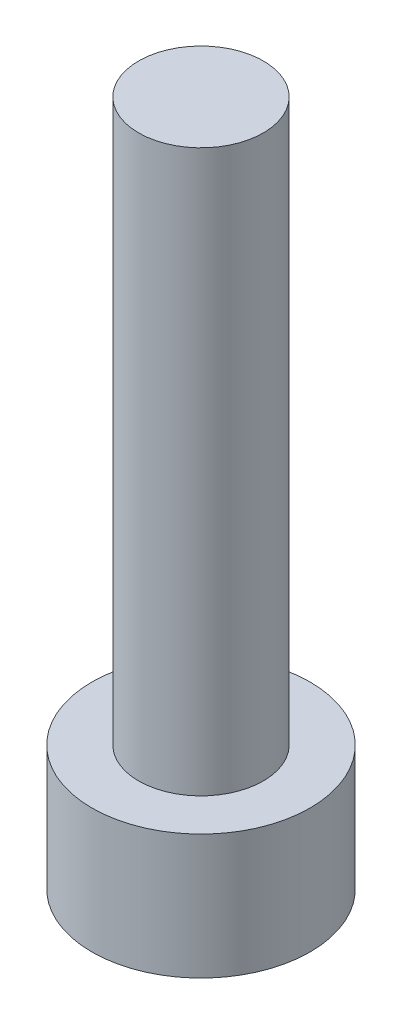
from build123d import *

# Parameters (mm, degrees)
SKETCH_1_R          = 3.5
EXTRUDE_1_DEPTH     = 4
SKETCH_2_R          = 2
EXTRUDE_2_DEPTH     = 18
CUT_EXTRUDE_1_DEPTH = 1.5


with BuildPart() as part:
    # 草图1 → 凸台-拉伸1 (new body)
    with BuildSketch(Plane(origin=(0, 0, 0), x_dir=(1, 0, 0), z_dir=(0, 1, 0))):
        with Locations(Location((0, 0, 0), (0, 0, 270))):
            Circle(SKETCH_1_R)
    extrude(amount=EXTRUDE_1_DEPTH)

    # 草图2 → 凸台-拉伸2 (add)
    with BuildSketch(Plane(origin=(0, 4, 0), x_dir=(1, 0, 0), z_dir=(0, 1, 0))):
        with Locations(Location((0, 0, 0), (0, 0, 270))):
            Circle(SKETCH_2_R)
    extrude(amount=EXTRUDE_2_DEPTH)

    # 草图3 → 切除-拉伸1 (cut)
    with BuildSketch(Plane.XZ):
        Polygon((1.271315405, -1.17633207), (1.654391159, 0.512825402), (0.383075754, 1.689157473), (-1.271315405, 1.17633207), (-1.654391159, -0.512825402), (-0.383075754, -1.689157473), align=None)
    extrude(amount=-CUT_EXTRUDE_1_DEPTH, mode=Mode.SUBTRACT)


solid = part.part
